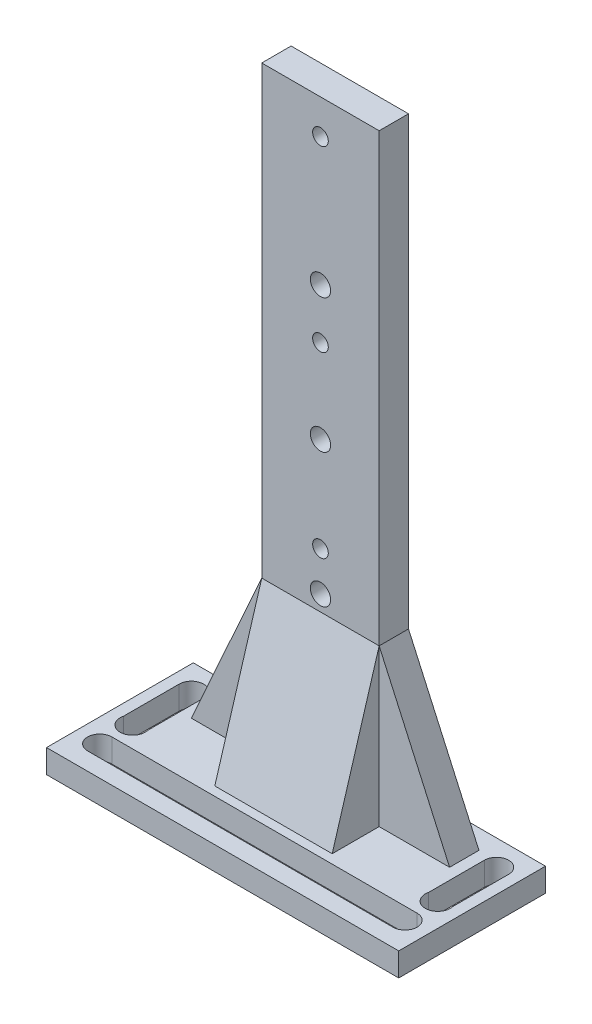
from build123d import *

# Parameters (mm, degrees)
SKETCH_1_W                = 90
SKETCH_1_H                = 90
EXTRUDE_1_DEPTH           = 6
SKETCH_2_W                = 30
SKETCH_2_H                = 40
EXTRUDE_2_DEPTH           = 160
EXTRUDE_3_DEPTH           = 20
SKETCH_8_R                = 3.1
CUT_EXTRUDE_2_DEPTH       = 6
EXTRUDE_4_DEPTH           = 15
CUT_EXTRUDE_4_DEPTH       = 173.191753577
CUT_EXTRUDE_4_DEPTH_BACK  = 173.191753577
SKETCH_17_W               = 25
SKETCH_17_H               = 154
SKETCH_21_W               = 15
SKETCH_21_H               = 6
CUT_EXTRUDE_8_DEPTH       = 173.191753577
SKETCH_23_W               = 78
SKETCH_23_H               = 6.2
CUT_EXTRUDE_9_DEPTH       = 173.191753577
MIRROR_14_COPY_1_SKETCH_R = 3.1
MIRROR_14_COPY_1_DEPTH    = 6
SKETCH_25_W               = 6.229282002
SKETCH_25_H               = 15
CUT_EXTRUDE_10_DEPTH      = 173.191753577
SKETCH_26_R               = 3.114641001
CUT_EXTRUDE_11_DEPTH      = 173.191753577
SKETCH_27_R               = 3.202321727
CUT_EXTRUDE_12_DEPTH      = 173.191753577
CUT_EXTRUDE_13_DEPTH      = 173.191753577
SKETCH_29_W               = 45
SKETCH_29_H               = 7.5
CUT_EXTRUDE_14_DEPTH      = 173.191753577
SKETCH_30_W               = 5
SKETCH_30_H               = 40
CUT_EXTRUDE_15_DEPTH      = 173.191753577
SKETCH_31_R               = 2
CUT_EXTRUDE_16_DEPTH      = 173.191753577
PATTERN_LINEAR_2_COUNT    = 3
PATTERN_LINEAR_2_PITCH    = 45.6
SKETCH_32_R               = 2.6
CUT_EXTRUDE_17_DEPTH      = 173.191753577
PATTERN_LINEAR_3_COUNT    = 3
PATTERN_LINEAR_3_PITCH    = 34.2


with BuildPart() as part:
    # 草图1 → 凸台-拉伸1 (new body)
    with BuildSketch(Plane(origin=(0, 0, 0), x_dir=(1, 0, 0), z_dir=(0, 1, 0))):
        Rectangle(SKETCH_1_W, SKETCH_1_H)
    extrude(amount=EXTRUDE_1_DEPTH)

    # 草图2 → 凸台-拉伸2 (add)
    with BuildSketch(Plane(origin=(0, 0, 0), x_dir=(1, 0, 0), z_dir=(0, 1, 0))):
        Rectangle(SKETCH_2_W, SKETCH_2_H)
    extrude(amount=EXTRUDE_2_DEPTH)

    # 草图7 → 凸台-拉伸3 (add)
    with BuildSketch(Plane.XY):
        Polygon((-15, 46), (-33, 6), (-15, 6), align=None)
    extrude_3 = extrude(amount=EXTRUDE_3_DEPTH)

    # 草图8 → 切除-拉伸2 (cut)
    with BuildSketch(Plane(origin=(0, 0, 0), x_dir=(1, 0, 0), z_dir=(0, 1, 0))):
        with Locations(Location((-39, 37.4, 0), (0, 0, 90))):
            Circle(SKETCH_8_R)
    cut_extrude_2 = extrude(amount=CUT_EXTRUDE_2_DEPTH, mode=Mode.SUBTRACT)

    # 草图15 → 凸台-拉伸4 (add, symmetric)
    with BuildSketch(Plane(origin=(0, 0, 0), x_dir=(0, 0, -1), z_dir=(1, 0, 0))):
        Polygon((-20, 46), (-20, 6), (-32, 6), align=None)
    extrude_4 = extrude(amount=EXTRUDE_4_DEPTH, both=True)

    # 镜向11: 凸台-拉伸4 across plane
    add(extrude_4.mirror(Plane.XY))

    # 草图17 → 切除-拉伸4 (cut, two sides: drawn at the far end of the back side and taken through both)
    with BuildSketch(Plane(origin=(0, 0, 0), x_dir=(0, 0, -1), z_dir=(1, 0, 0)).offset(-CUT_EXTRUDE_4_DEPTH_BACK)):
        with Locations((0, 83)):
            Rectangle(SKETCH_17_W, SKETCH_17_H)
    extrude(amount=CUT_EXTRUDE_4_DEPTH + CUT_EXTRUDE_4_DEPTH_BACK, mode=Mode.SUBTRACT)

    # 草图21 → 切除-拉伸8 (cut, through all)
    with BuildSketch(Plane(origin=(0, 0, 0), x_dir=(0, 0, -1), z_dir=(1, 0, 0))):
        with Locations((0, 3)):
            Rectangle(SKETCH_21_W, SKETCH_21_H)
    extrude(amount=-CUT_EXTRUDE_8_DEPTH, mode=Mode.SUBTRACT)

    # 镜向12: 切除-拉伸2 across plane
    add(cut_extrude_2.mirror(Plane(origin=(0, 0, 0), x_dir=(0, 0, 1), z_dir=(1, 0, 0))), mode=Mode.SUBTRACT)

    # 草图23 → 切除-拉伸9 (cut, through all)
    with BuildSketch(Plane(origin=(0, 0, 0), x_dir=(1, 0, 0), z_dir=(0, 1, 0))):
        with Locations((0, 37.4)):
            Rectangle(SKETCH_23_W, SKETCH_23_H)
    cut_extrude_9 = extrude(amount=CUT_EXTRUDE_9_DEPTH, mode=Mode.SUBTRACT)

    # 镜向13: 切除-拉伸9 across plane
    add(cut_extrude_9.mirror(Plane.XY), mode=Mode.SUBTRACT)

    # 镜向14: 切除-拉伸2 across plane
    add(cut_extrude_2.mirror(Plane.XY), mode=Mode.SUBTRACT)

    # 镜向14 copy 1 sketch → 镜向14 copy 1 (cut)
    with BuildSketch(Plane(origin=(0, 0, 0), x_dir=(-1, 0, 0), z_dir=(0, 1, 0))):
        with Locations(Location((-39, 37.4, 0), (0, 0, 90))):
            Circle(MIRROR_14_COPY_1_SKETCH_R)
    extrude(amount=MIRROR_14_COPY_1_DEPTH, mode=Mode.SUBTRACT)

    # 草图25 → 切除-拉伸10 (cut, through all)
    with BuildSketch(Plane(origin=(0, 0, 0), x_dir=(1, 0, 0), z_dir=(0, 1, 0))):
        with Locations((38.985358999, -21.5)):
            Rectangle(SKETCH_25_W, SKETCH_25_H)
    cut_extrude_10 = extrude(amount=CUT_EXTRUDE_10_DEPTH, mode=Mode.SUBTRACT)

    # 草图26 → 切除-拉伸11 (cut, through all)
    with BuildSketch(Plane(origin=(0, 0, 0), x_dir=(1, 0, 0), z_dir=(0, 1, 0))):
        with Locations((38.985358999, -14)):
            Circle(SKETCH_26_R)
    cut_extrude_11 = extrude(amount=CUT_EXTRUDE_11_DEPTH, mode=Mode.SUBTRACT)

    # 草图27 → 切除-拉伸12 (cut, through all)
    with BuildSketch(Plane(origin=(0, 0, 0), x_dir=(1, 0, 0), z_dir=(0, 1, 0))):
        with Locations((38.985358999, -29)):
            Circle(SKETCH_27_R)
    cut_extrude_12 = extrude(amount=CUT_EXTRUDE_12_DEPTH, mode=Mode.SUBTRACT)

    # 镜向15: 切除-拉伸10 across plane
    add(cut_extrude_10.mirror(Plane(origin=(0, 0, 0), x_dir=(0, 0, 1), z_dir=(1, 0, 0))), mode=Mode.SUBTRACT)

    # 镜向16: 切除-拉伸11 across plane
    add(cut_extrude_11.mirror(Plane(origin=(0, 0, 0), x_dir=(0, 0, 1), z_dir=(1, 0, 0))), mode=Mode.SUBTRACT)

    # 镜向17: 切除-拉伸12 across plane
    add(cut_extrude_12.mirror(Plane(origin=(0, 0, 0), x_dir=(0, 0, 1), z_dir=(1, 0, 0))), mode=Mode.SUBTRACT)

    # 镜向23: 凸台-拉伸3 across plane
    add(extrude_3.mirror(Plane(origin=(0, 0, 0), x_dir=(0, 0, 1), z_dir=(1, 0, 0))))

    # 草图28 → 切除-拉伸13 (cut, through all)
    with BuildSketch(Plane(origin=(0, 0, 0), x_dir=(1, 0, 0), z_dir=(0, 1, 0))):
        Polygon((45, 0), (0, 0), (0, 7.5), (-45, 7.5), (-45, 45), (45, 45), align=None)
    extrude(amount=CUT_EXTRUDE_13_DEPTH, mode=Mode.SUBTRACT)

    # 草图29 → 切除-拉伸14 (cut, through all)
    with BuildSketch(Plane(origin=(0, 0, 0), x_dir=(1, 0, 0), z_dir=(0, 1, 0))):
        with Locations((22.5, -3.75)):
            Rectangle(SKETCH_29_W, SKETCH_29_H)
    extrude(amount=CUT_EXTRUDE_14_DEPTH, mode=Mode.SUBTRACT)

    # 草图30 → 切除-拉伸15 (cut, through all)
    with BuildSketch(Plane(origin=(0, 0, 0), x_dir=(0, 0, -1), z_dir=(1, 0, 0))):
        with Locations((-10, 26)):
            Rectangle(SKETCH_30_W, SKETCH_30_H)
    extrude(amount=CUT_EXTRUDE_15_DEPTH, mode=Mode.SUBTRACT)

    # 草图31 → 切除-拉伸16 (cut, through all)
    with BuildSketch(Plane.XY):
        with Locations(Location((0, 60, 0), (0, 0, 180))):
            Circle(SKETCH_31_R)
    cut_extrude_16 = extrude(amount=CUT_EXTRUDE_16_DEPTH, mode=Mode.SUBTRACT)

    # 阵列(线性)2: 切除-拉伸16 ×3
    with Locations(*[(0, i * PATTERN_LINEAR_2_PITCH, 0) for i in range(1, PATTERN_LINEAR_2_COUNT)]):
        add(cut_extrude_16, mode=Mode.SUBTRACT)

    # 草图32 → 切除-拉伸17 (cut, through all)
    with BuildSketch(Plane.XY):
        with Locations(Location((0, 50, 0), (0, 0, 180))):
            Circle(SKETCH_32_R)
    cut_extrude_17 = extrude(amount=CUT_EXTRUDE_17_DEPTH, mode=Mode.SUBTRACT)

    # 阵列(线性)3: 切除-拉伸17 ×3
    with Locations(*[(0, i * PATTERN_LINEAR_3_PITCH, 0) for i in range(1, PATTERN_LINEAR_3_COUNT)]):
        add(cut_extrude_17, mode=Mode.SUBTRACT)


solid = part.part
